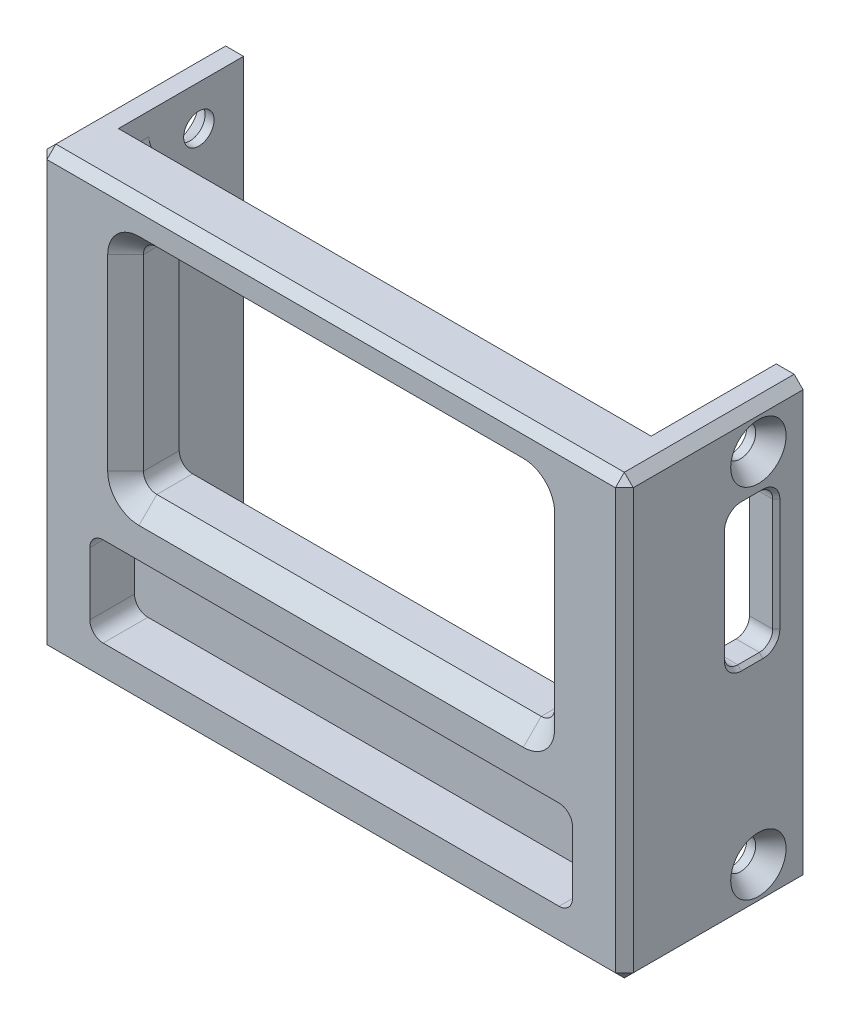
from build123d import *

# Parameters (mm, degrees)
SKETCH1_W           = 32.8
SKETCH1_H           = 24.5
BOSS_EXTRUDE1_DEPTH = 10
SKETCH3_W           = 29.8
SKETCH3_H           = 24.5
CUT_EXTRUDE2_DEPTH  = 5.3
CUT_EXTRUDE3_DEPTH  = 23.782065315
CUT_EXTRUDE4_DEPTH  = 1.5
CHAMFER1_SIZE       = 1
CHAMFER2_SIZE       = 0.2
CHAMFER3_SIZE       = 0.5
CUT_EXTRUDE6_DEPTH  = 2.5
SKETCH10_R          = 0.85
CUT_EXTRUDE7_DEPTH  = 1.5
CUT_EXTRUDE8_START  = -1.5
SKETCH9_R           = 0.85
CUT_EXTRUDE8_DEPTH  = 1.5
CHAMFER7_SIZE       = 0.7
CHAMFER7_SIZE2      = 0.999703605
CHAMFER8_SIZE       = 0.7
CHAMFER8_SIZE2      = 0.999703605
CUT_EXTRUDE11_DEPTH = 1.7


with BuildPart() as part:
    # Sketch1 → Boss-Extrude1 (new body)
    with BuildSketch(Plane.XY):
        Rectangle(SKETCH1_W, SKETCH1_H)
    extrude(amount=BOSS_EXTRUDE1_DEPTH)

    # Sketch3 → Cut-Extrude2 (cut)
    with BuildSketch(Plane(origin=(0, 0, 0), x_dir=(-1, 0, 0), z_dir=(0, 0, -1))):
        Rectangle(SKETCH3_W, SKETCH3_H)
    extrude(amount=-CUT_EXTRUDE2_DEPTH, mode=Mode.SUBTRACT)

    # Sketch4 → Cut-Extrude3 (cut, through all)
    with BuildSketch(Plane.XY.offset(10)):
        with BuildLine():
            Line((-10.75, -2.4), (10.75, -2.4))
            ThreePointArc((10.75, -2.4), (11.280330086, -2.180330086), (11.5, -1.65))
            Line((11.5, -1.65), (11.5, 8.85))
            ThreePointArc((11.5, 8.85), (11.280330086, 9.380330086), (10.75, 9.6))
            Line((10.75, 9.6), (-10.75, 9.6))
            ThreePointArc((-10.75, 9.6), (-11.280330086, 9.380330086), (-11.5, 8.85))
            Line((-11.5, 8.85), (-11.5, -1.65))
            ThreePointArc((-11.5, -1.65), (-11.280330086, -2.180330086), (-10.75, -2.4))
        make_face()
    extrude(amount=-CUT_EXTRUDE3_DEPTH, mode=Mode.SUBTRACT)

    # Sketch5 → Cut-Extrude4 (cut)
    with BuildSketch(Plane(origin=(16.4, 0, 0), x_dir=(0, 0, -1), z_dir=(1, 0, 0))):
        with BuildLine():
            Line((-3.45, 7.85), (-2.25, 7.85))
            ThreePointArc((-2.25, 7.85), (-1.719669914, 7.630330086), (-1.5, 7.1))
            Line((-1.5, 7.1), (-1.5, 0.8))
            ThreePointArc((-1.5, 0.8), (-1.719669914, 0.269669914), (-2.25, 0.05))
            Line((-2.25, 0.05), (-3.45, 0.05))
            ThreePointArc((-3.45, 0.05), (-3.980330086, 0.269669914), (-4.2, 0.8))
            Line((-4.2, 0.8), (-4.2, 7.1))
            ThreePointArc((-4.2, 7.1), (-3.980330086, 7.630330086), (-3.45, 7.85))
        make_face()
    extrude(amount=-CUT_EXTRUDE4_DEPTH, mode=Mode.SUBTRACT)

    # Chamfer1
    chamfer1_edges = [part.edges().sort_by_distance(p)[0] for p in [
        (-11.280330086, -2.180330086, 10),
        (0, -2.4, 10),
        (11.280330086, -2.180330086, 10),
        (11.5, 3.6, 10),
        (11.280330086, 9.380330086, 10),
        (0, 9.6, 10),
        (-11.280330086, 9.380330086, 10),
        (-11.5, 3.6, 10),
    ]]
    chamfer(chamfer1_edges, length=CHAMFER1_SIZE)

    # Chamfer2
    chamfer2_edges = [part.edges().sort_by_distance(p)[0] for p in [
        (16.4, 7.85, 2.85),
        (16.4, 3.95, 1.5),
        (16.4, 7.630330086, 3.980330086),
        (16.4, 3.95, 4.2),
        (16.4, 0.269669914, 3.980330086),
        (16.4, 0.05, 2.85),
        (16.4, 0.269669914, 1.719669914),
        (16.4, 7.630330086, 1.719669914),
    ]]
    chamfer(chamfer2_edges, length=CHAMFER2_SIZE)

    # Chamfer3
    chamfer3_edges = [part.edges().sort_by_distance(p)[0] for p in [
        (-16.4, 0, 10),
        (0, -12.25, 10),
        (16.4, 0, 10),
        (0, 12.25, 10),
        (16.4, -12.25, 5),
        (-16.4, -12.25, 5),
        (-16.4, 12.25, 5),
        (16.4, 12.25, 5),
    ]]
    chamfer(chamfer3_edges, length=CHAMFER3_SIZE)

    # Sketch8 → Cut-Extrude6 (cut)
    with BuildSketch(Plane.XY.offset(10)):
        with BuildLine():
            Line((-12.75, -10.1), (12.75, -10.1))
            ThreePointArc((12.75, -10.1), (13.280330086, -9.880330086), (13.5, -9.35))
            Line((13.5, -9.35), (13.5, -5.85))
            ThreePointArc((13.5, -5.85), (13.280330086, -5.319669914), (12.75, -5.1))
            Line((12.75, -5.1), (-12.75, -5.1))
            ThreePointArc((-12.75, -5.1), (-13.280330086, -5.319669914), (-13.5, -5.85))
            Line((-13.5, -5.85), (-13.5, -9.35))
            ThreePointArc((-13.5, -9.35), (-13.280330086, -9.880330086), (-12.75, -10.1))
        make_face()
    extrude(amount=-CUT_EXTRUDE6_DEPTH, mode=Mode.SUBTRACT)

    # Sketch10 → Cut-Extrude7 (cut)
    with BuildSketch(Plane.ZY.offset(16.4)):
        with Locations((2.5, 10)):
            Circle(SKETCH10_R)
        with Locations((2.5, -10)):
            Circle(SKETCH10_R)
    extrude(amount=-CUT_EXTRUDE7_DEPTH, mode=Mode.SUBTRACT)

    # Sketch9 → Cut-Extrude8 (cut)
    with BuildSketch(Plane(origin=(16.4, 0, 0), x_dir=(0, 0, -1), z_dir=(1, 0, 0)).offset(CUT_EXTRUDE8_START)):
        with Locations(Location((-2.5, -10, 0), (0, 0, 180))):
            Circle(SKETCH9_R)
        with Locations(Location((-2.5, 10, 0), (0, 0, 180))):
            Circle(SKETCH9_R)
    extrude(amount=CUT_EXTRUDE8_DEPTH, mode=Mode.SUBTRACT)

    # Chamfer7
    chamfer7_edges = [part.edges().sort_by_distance(p)[0] for p in [
        (-16.4, 10, 1.65),
        (-16.4, -10, 1.65),
    ]]
    chamfer7_side = [part.faces().sort_by_distance(p)[0] for p in [
        (-16.4, 0, 4.796701497),
    ]]
    chamfer(chamfer7_edges, length=CHAMFER7_SIZE, length2=CHAMFER7_SIZE2, reference=chamfer7_side[0])

    # Chamfer8
    chamfer8_edges = [part.edges().sort_by_distance(p)[0] for p in [
        (16.4, -10, 1.65),
        (16.4, 10, 1.65),
    ]]
    chamfer8_side = [part.faces().sort_by_distance(p)[0] for p in [
        (16.4, -0.501630017, 5.043922739),
    ]]
    chamfer(chamfer8_edges, length=CHAMFER8_SIZE, length2=CHAMFER8_SIZE2, reference=chamfer8_side[0])

    # Sketch15 → Cut-Extrude11 (cut)
    with BuildSketch(Plane(origin=(0, 0, 5.3), x_dir=(-1, 0, 0), z_dir=(0, 0, -1))):
        with BuildLine():
            Line((-14.9, 12.25), (14.9, 12.25))
            Line((14.9, 12.25), (14.9, 11.001705033))
            ThreePointArc((14.9, 11.001705033), (14.680330086, 10.471374947), (14.15, 10.251705033))
            Line((14.15, 10.251705033), (13.900532635, 10.251705033))
            Line((13.900532635, 10.251705033), (13.900532635, -10.246251607))
            Line((13.900532635, -10.246251607), (14.15, -10.246251607))
            ThreePointArc((14.15, -10.246251607), (14.680330086, -10.465921521), (14.9, -10.996251607))
            Line((14.9, -10.996251607), (14.9, -12.25))
            Line((14.9, -12.25), (-14.9, -12.25))
            Line((-14.9, -12.25), (-14.9, -10.996251607))
            ThreePointArc((-14.9, -10.996251607), (-14.680330086, -10.465921521), (-14.15, -10.246251607))
            Line((-14.15, -10.246251607), (-13.902617277, -10.246251607))
            Line((-13.902617277, -10.246251607), (-13.902617277, 10.251705033))
            Line((-13.902617277, 10.251705033), (-14.15, 10.251705033))
            ThreePointArc((-14.15, 10.251705033), (-14.680330086, 10.471374947), (-14.9, 11.001705033))
            Line((-14.9, 11.001705033), (-14.9, 12.25))
        make_face()
    extrude(amount=-CUT_EXTRUDE11_DEPTH, mode=Mode.SUBTRACT)


solid = part.part
